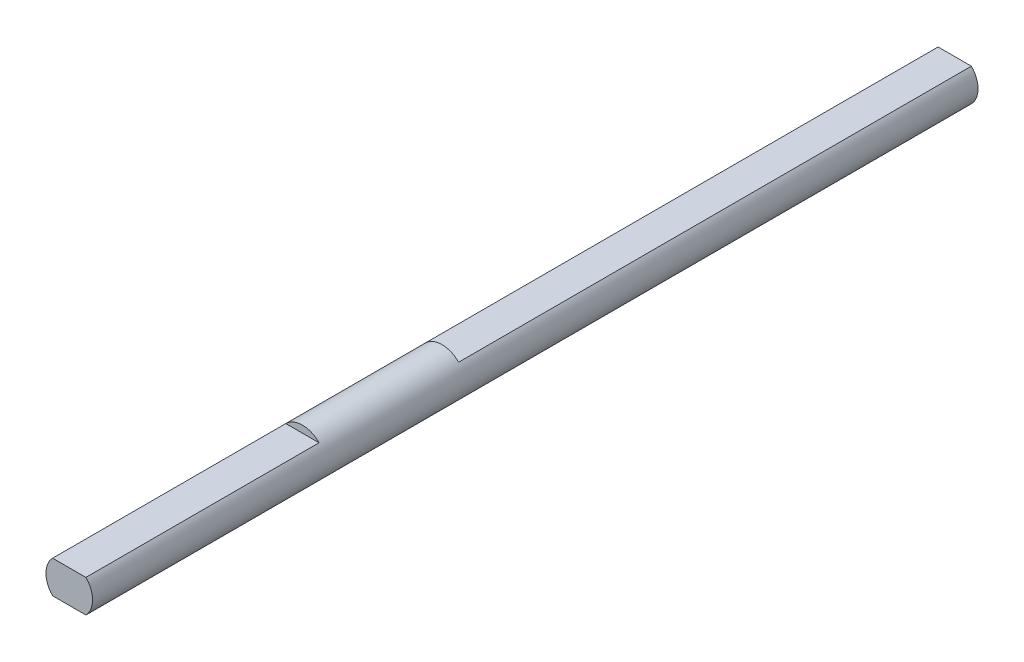
from build123d import *

# Parameters (mm, degrees)
RESSALTO_EXTRUS_O1_DEPTH      = 65
RESSALTO_EXTRUS_O1_DEPTH_BACK = 30
ESBO_O1_R                     = 2.5
CORTE_EXTRUS_O4_DEPTH         = 25.015
CORTE_EXTRUS_O5_DEPTH         = 55.015


with BuildPart() as part:
    # Esboço1 → Ressalto-extrusão1 (new, two sides: drawn at the far end of the back side and taken through both)
    with BuildSketch(Plane.XY.offset(-RESSALTO_EXTRUS_O1_DEPTH_BACK)):
        Circle(ESBO_O1_R)
    extrude(amount=RESSALTO_EXTRUS_O1_DEPTH + RESSALTO_EXTRUS_O1_DEPTH_BACK)

    # Esboço5 → Corte-extrusão4 (cut)
    with BuildSketch(Plane.XY.offset(65)):
        Polygon((0, 1.75), (2.691542187, 1.75), (2.691542187, 3.079428638), (-3.67257147, 3.079428638), (-3.67257147, 1.75), align=None)
        Polygon((0, -1.75), (2.691542187, -1.75), (2.691542187, -3.180047036), (-3.67257147, -3.180047036), (-3.67257147, -1.75), align=None)
    extrude(amount=-CORTE_EXTRUS_O4_DEPTH, mode=Mode.SUBTRACT)

    # Esboço6 → Corte-extrusão5 (cut)
    with BuildSketch(Plane(origin=(0, 0, -30), x_dir=(-1, 0, 0), z_dir=(0, 0, -1))):
        Polygon((0, 1.75), (2.641232941, 1.75), (2.641232941, 2.913827525), (-2.871816769, 2.913827525), (-2.871816769, 1.75), align=None)
        Polygon((0, -1.75), (2.641232941, -1.75), (2.641232941, -3.018638356), (-2.871816769, -3.018638356), (-2.871816769, -1.75), align=None)
    extrude(amount=-CORTE_EXTRUS_O5_DEPTH, mode=Mode.SUBTRACT)


solid = part.part
